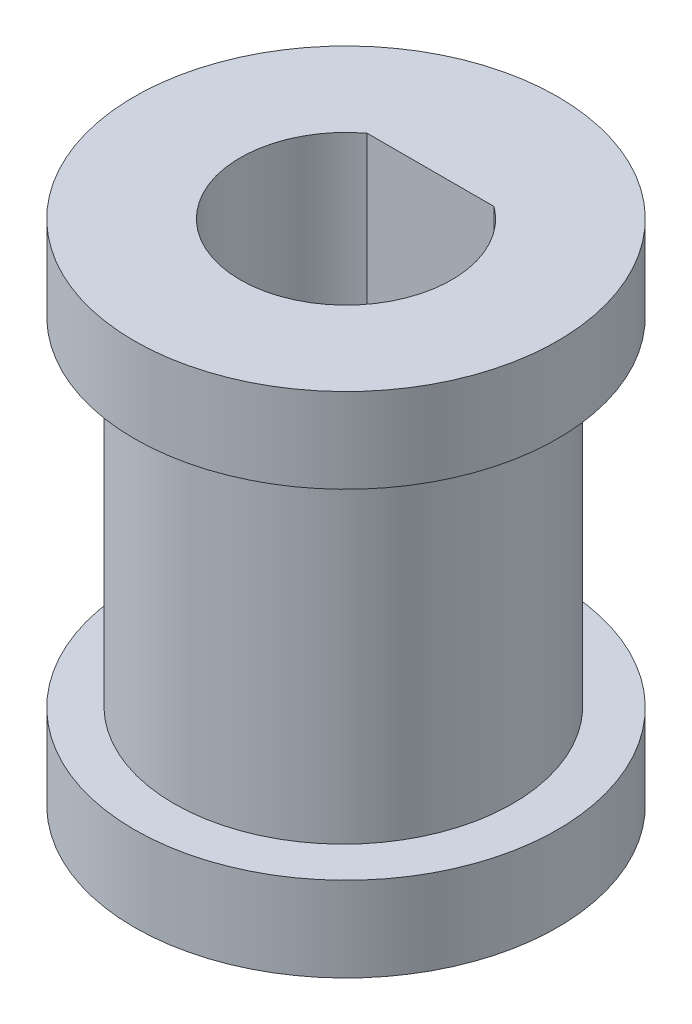
from build123d import *

# Parameters (mm, degrees)
SKETCH_1_R      = 4
EXTRUDE_1_DEPTH = 10
SKETCH_2_R      = 5
EXTRUDE_3_DEPTH = 2
SKETCH_4_R      = 5
EXTRUDE_4_DEPTH = 2


with BuildPart() as part:
    # 草图1 → 凸台-拉伸1 (new body)
    with BuildSketch(Plane(origin=(0, 0, 0), x_dir=(1, 0, 0), z_dir=(0, 1, 0))):
        with Locations(Location((-0.063005912, 0, 0), (0, 0, 270))):
            Circle(SKETCH_1_R)
        with BuildLine():
            Line((-1.5, 2), (1.5, 2))
            ThreePointArc((1.5, 2), (0, -2.5), (-1.5, 2))
        make_face(mode=Mode.SUBTRACT)
    extrude(amount=EXTRUDE_1_DEPTH)

    # 草图2 → 凸台-拉伸3 (add)
    with BuildSketch(Plane(origin=(0, 0, 0), x_dir=(1, 0, 0), z_dir=(0, 1, 0))):
        with Locations(Location((0, 0, 0), (0, 0, 270))):
            Circle(SKETCH_2_R)
        with BuildLine():
            Line((-1.5, 2), (1.5, 2))
            ThreePointArc((1.5, 2), (0, -2.5), (-1.5, 2))
        make_face(mode=Mode.SUBTRACT)
    extrude(amount=EXTRUDE_3_DEPTH)

    # 草图4 → 凸台-拉伸4 (add)
    with BuildSketch(Plane(origin=(0, 10, 0), x_dir=(1, 0, 0), z_dir=(0, 1, 0))):
        with Locations(Location((0, 0, 0), (0, 0, 270))):
            Circle(SKETCH_4_R)
        with BuildLine():
            Line((-1.5, 2), (1.5, 2))
            ThreePointArc((1.5, 2), (0, -2.5), (-1.5, 2))
        make_face(mode=Mode.SUBTRACT)
    extrude(amount=EXTRUDE_4_DEPTH)


solid = part.part
